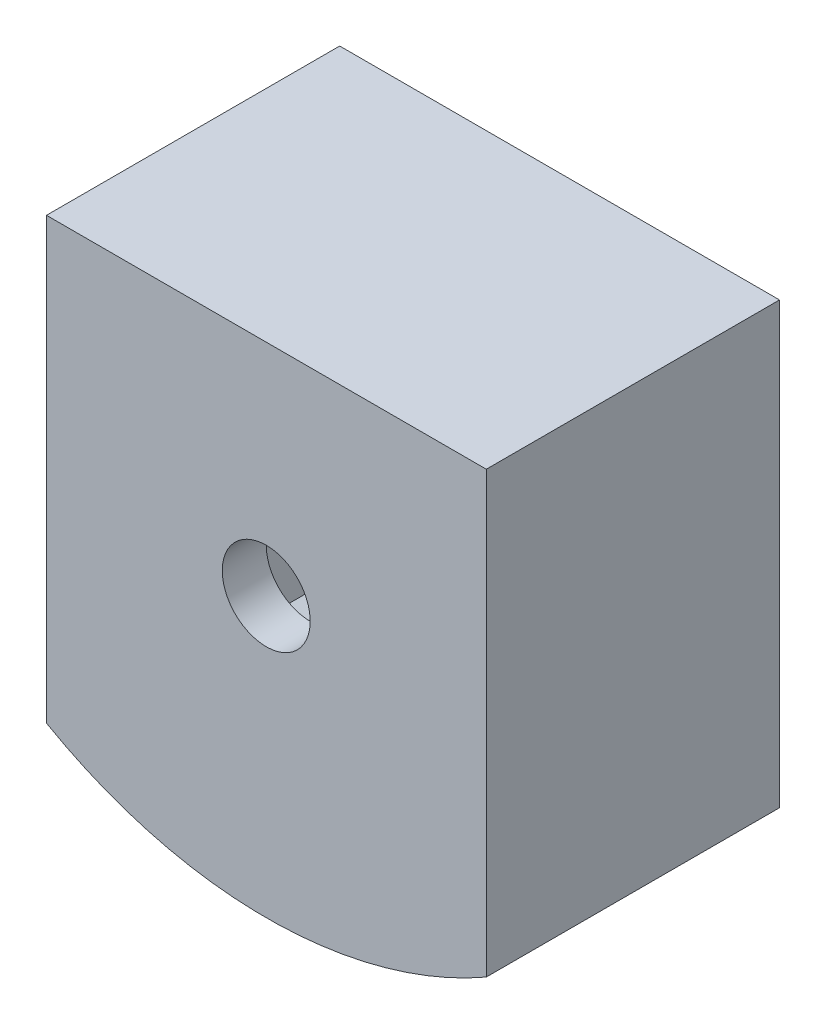
from build123d import *

# Parameters (mm, degrees)
BOSS_EXTRUDE1_DEPTH = 20
SHELL13_T           = -3
SKETCH3_R           = 3
CUT_EXTRUDE2_DEPTH  = 3
SKETCH4_W           = 10
SKETCH4_H           = 1
SKETCH4_W_2         = 1
SKETCH4_H_2         = 10
SKETCH4_W_3         = 7
CUT_EXTRUDE3_DEPTH  = 5


with BuildPart() as part:
    # Sketch1 → Boss-Extrude1 (new body)
    with BuildSketch(Plane.XY):
        with BuildLine():
            Line((15, -15), (15, 15))
            Line((15, 15), (-15, 15))
            Line((-15, 15), (-15, -15))
            ThreePointArc((-15, -15), (0, -19.004680178), (15, -15))
        make_face()
    extrude(amount=BOSS_EXTRUDE1_DEPTH)

    # Shell13
    shell13_openings = [part.faces().sort_by_distance(p)[0] for p in [
        (0, -1.375060702, 0),
    ]]
    offset(amount=SHELL13_T, openings=shell13_openings, kind=Kind.INTERSECTION)

    # Sketch3 → Cut-Extrude2 (cut)
    with BuildSketch(Plane(origin=(0, 0, 17), x_dir=(-1, 0, 0), z_dir=(0, 0, -1))):
        with Locations((0.010259738, 0.007572697)):
            Circle(SKETCH3_R)
    extrude(amount=-CUT_EXTRUDE2_DEPTH, mode=Mode.SUBTRACT)

    # Sketch4 → Cut-Extrude3 (cut)
    with BuildSketch(Plane(origin=(0, 0, 0), x_dir=(-1, 0, 0), z_dir=(0, 0, -1))):
        with Locations((0, 13.5)):
            Rectangle(SKETCH4_W, SKETCH4_H)
        with Locations((-13.5, 0)):
            Rectangle(SKETCH4_W_2, SKETCH4_H_2)
        with Locations((0, -17.5)):
            Rectangle(SKETCH4_W_3, SKETCH4_H)
        with Locations((13.5, 0)):
            Rectangle(SKETCH4_W_2, SKETCH4_H_2)
    extrude(amount=-CUT_EXTRUDE3_DEPTH, mode=Mode.SUBTRACT)


solid = part.part
